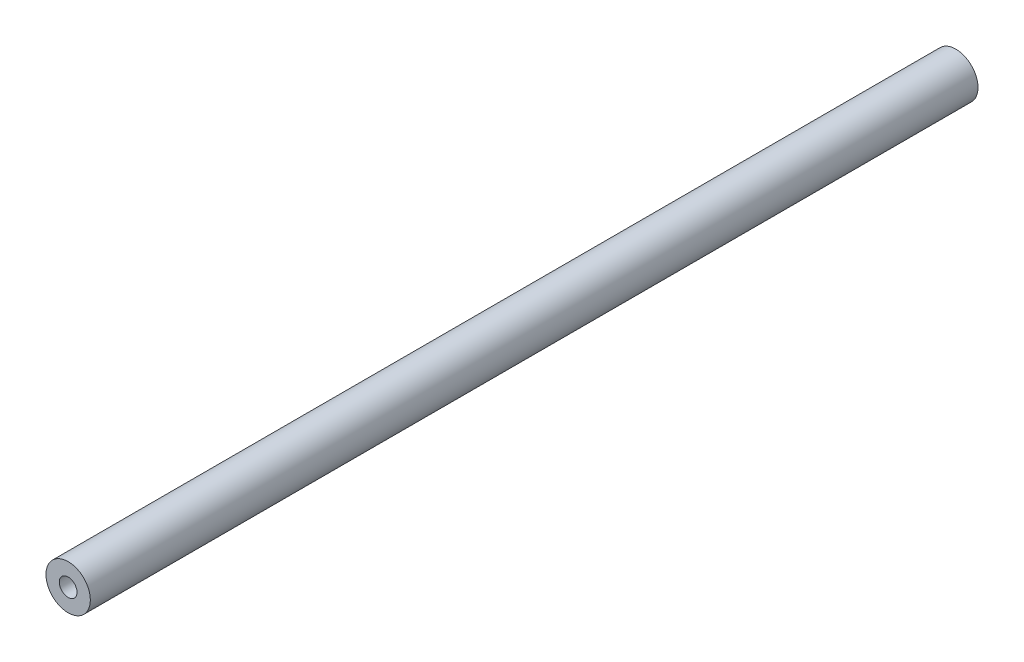
from build123d import *

# Parameters (mm, degrees)
SKETCH1_R           = 7.5
BOSS_EXTRUDE1_DEPTH = 300
SKETCH2_R           = 3
CUT_EXTRUDE1_DEPTH  = 30
CUT_EXTRUDE2_START  = -30
SKETCH3_R           = 3
CUT_EXTRUDE2_DEPTH  = 30


with BuildPart() as part:
    # Sketch1 → Boss-Extrude1 (new body)
    with BuildSketch(Plane.XY):
        Circle(SKETCH1_R)
    extrude(amount=BOSS_EXTRUDE1_DEPTH)

    # Sketch2 → Cut-Extrude1 (cut)
    with BuildSketch(Plane(origin=(0, 0, 0), x_dir=(-1, 0, 0), z_dir=(0, 0, -1))):
        Circle(SKETCH2_R)
    extrude(amount=-CUT_EXTRUDE1_DEPTH, mode=Mode.SUBTRACT)

    # Sketch3 → Cut-Extrude2 (cut)
    with BuildSketch(Plane.XY.offset(300).offset(CUT_EXTRUDE2_START)):
        with Locations(Location((0, 0, 0), (0, 0, 180))):
            Circle(SKETCH3_R)
    extrude(amount=CUT_EXTRUDE2_DEPTH, mode=Mode.SUBTRACT)


solid = part.part
